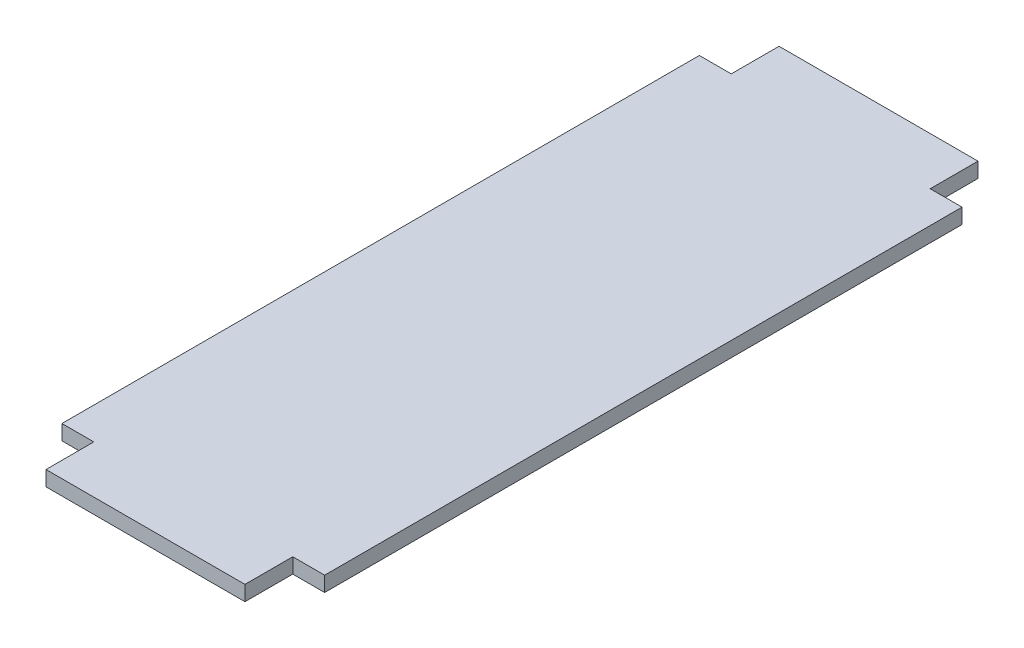
from build123d import *

# Parameters (mm, degrees)
BOSS_EXTRUDE1_DEPTH = 2.9972


with BuildPart() as part:
    # Sketch1 → Boss-Extrude1 (new body)
    with BuildSketch(Plane(origin=(0, 0, 0), x_dir=(1, 0, 0), z_dir=(0, 1, 0))):
        Polygon((-19.8190231, -73.025), (19.8190231, -73.025), (19.8190231, -63.5), (26.1690231, -63.5), (26.1690231, 63.5), (19.8190231, 63.5), (19.8190231, 73.025), (-19.8190231, 73.025), (-19.8190231, 63.5), (-26.1690231, 63.5), (-26.1690231, -63.5), (-19.8190231, -63.5), align=None)
    extrude(amount=BOSS_EXTRUDE1_DEPTH)


solid = part.part
